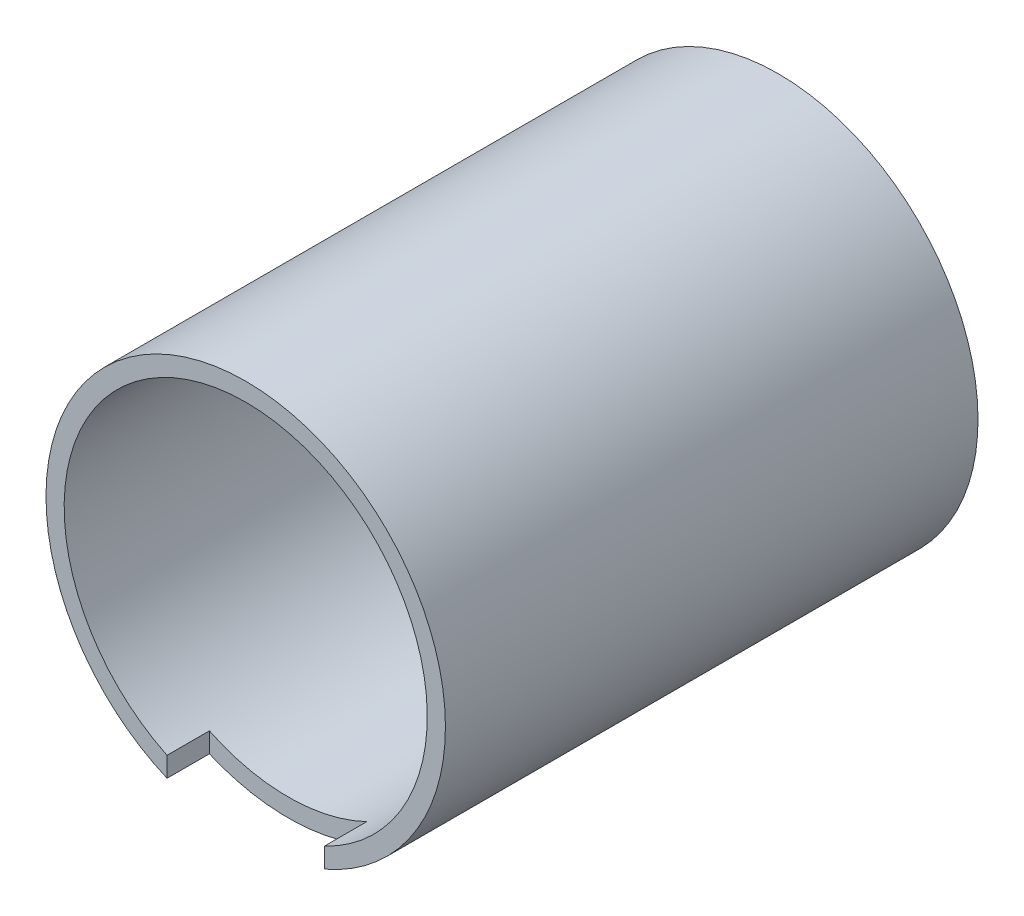
from build123d import *

# Parameters (mm, degrees)
SKETCH1_R           = 16.5
SKETCH1_R_2         = 15
BOSS_EXTRUDE1_DEPTH = 44
SKETCH2_W           = 13
SKETCH2_H           = 3.5
CUT_EXTRUDE1_DEPTH  = 44


with BuildPart() as part:
    # Sketch1 → Boss-Extrude1 (new body)
    with BuildSketch(Plane.XY):
        Circle(SKETCH1_R)
        Circle(SKETCH1_R_2, mode=Mode.SUBTRACT)
    extrude(amount=BOSS_EXTRUDE1_DEPTH)

    # Sketch2 → Cut-Extrude1 (cut)
    with BuildSketch(Plane(origin=(0, 0, 0), x_dir=(1, 0, 0), z_dir=(0, 1, 0))):
        with Locations((0, -1.75)):
            Rectangle(SKETCH2_W, SKETCH2_H)
        with Locations((0, -42.25)):
            Rectangle(SKETCH2_W, SKETCH2_H)
    extrude(amount=-CUT_EXTRUDE1_DEPTH, mode=Mode.SUBTRACT)


solid = part.part
